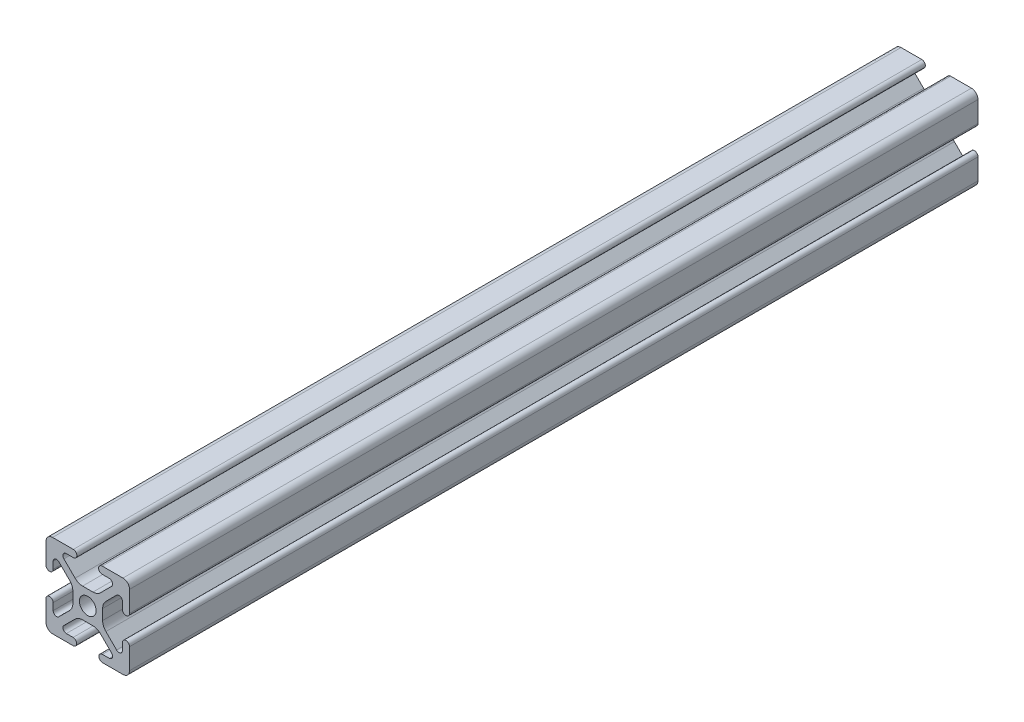
from build123d import *

# Parameters (mm, degrees)
SKETCH1_R           = 2.5
BOSS_EXTRUDE1_DEPTH = 254


with BuildPart() as part:
    # Sketch1 → Boss-Extrude1 (new body)
    with BuildSketch(Plane(origin=(0, 0, -381), x_dir=(-1, 0, 0), z_dir=(0, 0, -1))):
        with BuildLine():
            Line((12.5, 4.32), (12.5, 10.537068835))
            ThreePointArc((12.5, 10.537068835), (11.925070773, 11.925070773), (10.537068835, 12.5))
            Line((10.537068835, 12.5), (4.32, 12.5))
            ThreePointArc((4.32, 12.5), (3.25, 11.43), (4.32, 10.36))
            Line((4.32, 10.36), (6.42, 10.36))
            ThreePointArc((6.42, 10.36), (7.35325999, 9.736168088), (7.133653912, 8.635298598))
            Line((7.133653912, 8.635298598), (3.795290766, 5.301828272))
            ThreePointArc((3.795290766, 5.301828272), (2.76743922, 4.61585726), (1.555406707, 4.375))
            Line((1.555406707, 4.375), (-1.555406707, 4.375))
            ThreePointArc((-1.555406707, 4.375), (-2.76743922, 4.61585726), (-3.795290766, 5.301828272))
            Line((-3.795290766, 5.301828272), (-7.133653912, 8.635298598))
            ThreePointArc((-7.133653912, 8.635298598), (-7.35325999, 9.736168088), (-6.42, 10.36))
            Line((-6.42, 10.36), (-4.32, 10.36))
            ThreePointArc((-4.32, 10.36), (-3.25, 11.43), (-4.32, 12.5))
            Line((-4.32, 12.5), (-10.537068835, 12.5))
            ThreePointArc((-10.537068835, 12.5), (-11.925070773, 11.925070773), (-12.5, 10.537068835))
            Line((-12.5, 10.537068835), (-12.5, 4.32))
            ThreePointArc((-12.5, 4.32), (-11.43, 3.25), (-10.36, 4.32))
            Line((-10.36, 4.32), (-10.36, 6.396886949))
            ThreePointArc((-10.36, 6.396886949), (-9.736852394, 7.329863489), (-8.636346088, 7.111588351))
            Line((-8.636346088, 7.111588351), (-5.432204773, 3.912143135))
            ThreePointArc((-5.432204773, 3.912143135), (-4.708985779, 2.831057106), (-4.455, 1.555406707))
            Line((-4.455, 1.555406707), (-4.455, -1.555406707))
            ThreePointArc((-4.455, -1.555406707), (-4.708985779, -2.831057106), (-5.432204773, -3.912143135))
            Line((-5.432204773, -3.912143135), (-8.636346088, -7.111588351))
            ThreePointArc((-8.636346088, -7.111588351), (-9.736852394, -7.329863489), (-10.36, -6.396886949))
            Line((-10.36, -6.396886949), (-10.36, -4.32))
            ThreePointArc((-10.36, -4.32), (-11.43, -3.25), (-12.5, -4.32))
            Line((-12.5, -4.32), (-12.5, -10.537068835))
            ThreePointArc((-12.5, -10.537068835), (-11.925070773, -11.925070773), (-10.537068835, -12.5))
            Line((-10.537068835, -12.5), (-4.387856959, -12.5))
            ThreePointArc((-4.387856959, -12.5), (-3.317856959, -11.43), (-4.387856959, -10.36))
            Line((-4.387856959, -10.36), (-6.42, -10.36))
            ThreePointArc((-6.42, -10.36), (-7.35325999, -9.736168088), (-7.133653912, -8.635298598))
            Line((-7.133653912, -8.635298598), (-3.795290766, -5.301828272))
            ThreePointArc((-3.795290766, -5.301828272), (-2.76743922, -4.61585726), (-1.555406707, -4.375))
            Line((-1.555406707, -4.375), (1.555406707, -4.375))
            ThreePointArc((1.555406707, -4.375), (2.76743922, -4.61585726), (3.795290766, -5.301828272))
            Line((3.795290766, -5.301828272), (7.133653912, -8.635298598))
            ThreePointArc((7.133653912, -8.635298598), (7.35325999, -9.736168088), (6.42, -10.36))
            Line((6.42, -10.36), (4.387856959, -10.36))
            ThreePointArc((4.387856959, -10.36), (3.317856959, -11.43), (4.387856959, -12.5))
            Line((4.387856959, -12.5), (10.537068835, -12.5))
            ThreePointArc((10.537068835, -12.5), (11.925070773, -11.925070773), (12.5, -10.537068835))
            Line((12.5, -10.537068835), (12.5, -4.32))
            ThreePointArc((12.5, -4.32), (11.43, -3.25), (10.36, -4.32))
            Line((10.36, -4.32), (10.36, -6.396886949))
            ThreePointArc((10.36, -6.396886949), (9.736852394, -7.329863489), (8.636346088, -7.111588351))
            Line((8.636346088, -7.111588351), (5.432204773, -3.912143135))
            ThreePointArc((5.432204773, -3.912143135), (4.708985779, -2.831057106), (4.455, -1.555406707))
            Line((4.455, -1.555406707), (4.455, 1.555406707))
            ThreePointArc((4.455, 1.555406707), (4.708985779, 2.831057106), (5.432204773, 3.912143135))
            Line((5.432204773, 3.912143135), (8.636346088, 7.111588351))
            ThreePointArc((8.636346088, 7.111588351), (9.736852394, 7.329863489), (10.36, 6.396886949))
            Line((10.36, 6.396886949), (10.36, 4.32))
            ThreePointArc((10.36, 4.32), (11.43, 3.25), (12.5, 4.32))
        make_face()
        with Locations(Location((0, 0, 0), (0, 0, 180))):
            Circle(SKETCH1_R, mode=Mode.SUBTRACT)
    extrude(amount=-BOSS_EXTRUDE1_DEPTH)


solid = part.part
